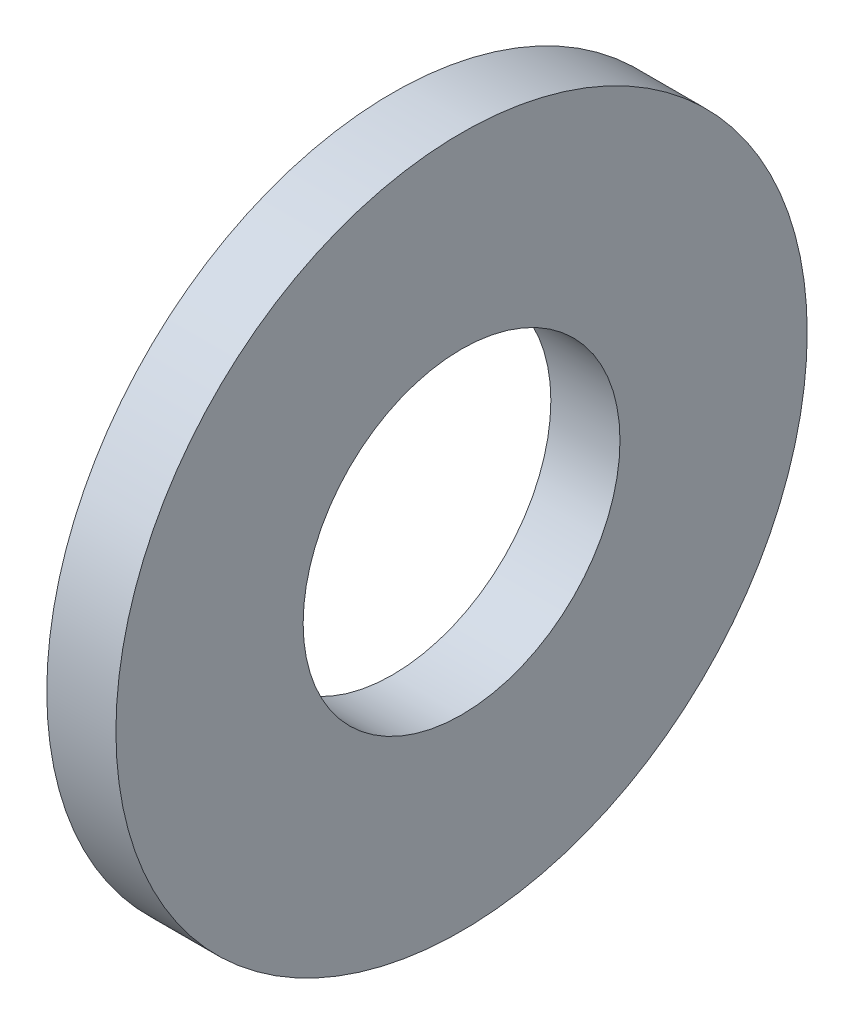
from build123d import *

# Parameters (mm, degrees)
SKETCH1_R          = 3
SKETCH1_R_2        = 1.375
BASE_EXTRUDE_DEPTH = 0.6


with BuildPart() as part:
    # Sketch1 → Base-Extrude (new body)
    with BuildSketch(Plane(origin=(0, 0, 0), x_dir=(0, 0, -1), z_dir=(1, 0, 0))):
        Circle(SKETCH1_R)
        Circle(SKETCH1_R_2, mode=Mode.SUBTRACT)
    extrude(amount=BASE_EXTRUDE_DEPTH)


solid = part.part
